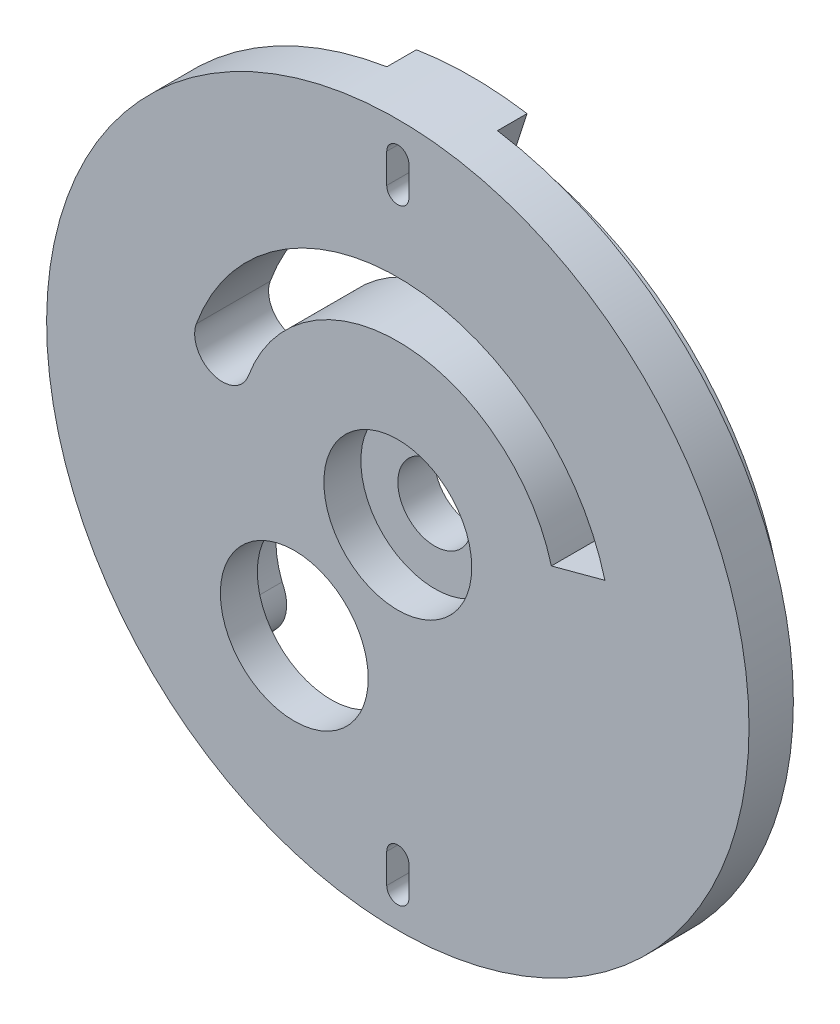
from build123d import *

# Parameters (mm, degrees)
ESQUISSE1_R             = 950
ESQUISSE1_R_2           = 100
ESQUISSE1_R_3           = 200
BOSS_EXTRU_2_DEPTH      = 200
ESQUISSE4_R             = 200
ENL_V_MAT_EXTRU_2_DEPTH = 100
ESQUISSE5_R             = 200
ENL_V_MAT_EXTRU_3_DEPTH = 100
ENL_V_MAT_EXTRU_4_DEPTH = 80


with BuildPart() as part:
    # Esquisse1 → Boss.-Extru.2 (new body)
    with BuildSketch(Plane.XY):
        Circle(ESQUISSE1_R)
        Circle(ESQUISSE1_R_2, mode=Mode.SUBTRACT)
        with Locations((-280, -400)):
            Circle(ESQUISSE1_R_3, mode=Mode.SUBTRACT)
        with BuildLine():
            Line((30, -780), (30, -860))
            ThreePointArc((30, -860), (0, -890), (-30, -860))
            Line((-30, -860), (-30, -780))
            ThreePointArc((-30, -780), (0, -750), (30, -780))
        make_face(mode=Mode.SUBTRACT)
        with BuildLine():
            Line((415.348105304, 111.292189394), (560.236979248, 150.115046159))
            ThreePointArc((560.236979248, 150.115046159), (25.299244672, 579.447968517), (-545.021720056, 198.371683129))
            ThreePointArc((-545.021720056, 198.371683129), (-500.196284246, 102.243225821), (-404.067826938, 147.06866163))
            ThreePointArc((-404.067826938, 147.06866163), (18.756336567, 429.59073528), (415.348105304, 111.292189394))
        make_face(mode=Mode.SUBTRACT)
        with BuildLine():
            Line((30, 780), (30, 860))
            ThreePointArc((30, 860), (0, 890), (-30, 860))
            Line((-30, 860), (-30, 780))
            ThreePointArc((-30, 780), (0, 750), (30, 780))
        make_face(mode=Mode.SUBTRACT)
    extrude(amount=BOSS_EXTRU_2_DEPTH)

    # Esquisse4 → Enlèv. mat.-Extru.2 (cut)
    with BuildSketch(Plane.XY.offset(200)):
        Circle(ESQUISSE4_R)
    extrude(amount=-ENL_V_MAT_EXTRU_2_DEPTH, mode=Mode.SUBTRACT)

    # Esquisse5 → Enlèv. mat.-Extru.3 (cut)
    with BuildSketch(Plane(origin=(0, 0, 0), x_dir=(-1, 0, 0), z_dir=(0, 0, -1))):
        with BuildLine():
            ThreePointArc((201.863253444, -825.682279638), (390.762908215, -754.853859739), (557.650174642, -641.503143189))
            Line((557.650174642, -641.503143189), (525.236890093, -604.21592467))
            ThreePointArc((525.236890093, -604.21592467), (501.276797335, -549.262070437), (513.052344937, -490.479856982))
            ThreePointArc((513.052344937, -490.479856982), (380.433331839, -171.060824987), (55.598868761, -289.799581223))
            ThreePointArc((55.598868761, -289.799581223), (12.641866668, -335.439232515), (-49.041983374, -346.547087517))
            ThreePointArc((-49.041983374, -346.547087517), (-213.58758579, -277.273048088), (-322.558312447, -135.853358705))
            ThreePointArc((-322.558312447, -135.853358705), (-366.878979382, -86.853774186), (-432.082648055, -76.187828748))
            Line((-432.082648055, -76.187828748), (-532.616227494, -93.91461127))
            ThreePointArc((-532.616227494, -93.91461127), (-602.060758652, -142.755312647), (-608.933484223, -227.376365948))
            ThreePointArc((-608.933484223, -227.376365948), (-372.346828507, -532.783107184), (-4.23006723, -649.986235648))
            ThreePointArc((-4.23006723, -649.986235648), (48.386746731, -665.352188625), (84.998557826, -706.147003376))
            Line((84.998557826, -706.147003376), (148.761821167, -836.881067155))
            ThreePointArc((148.761821167, -836.881067155), (175.401935414, -831.705573537), (201.863253444, -825.682279638))
        make_face()
        with Locations((280, -400)):
            Circle(ESQUISSE5_R, mode=Mode.SUBTRACT)
    extrude(amount=-ENL_V_MAT_EXTRU_3_DEPTH, mode=Mode.SUBTRACT)

    # Esquisse6 → Enlèv. mat.-Extru.4 (cut)
    with BuildSketch(Plane(origin=(0, 0, 0), x_dir=(-1, 0, 0), z_dir=(0, 0, -1))):
        with BuildLine():
            Line((-118.297135816, 841.72785843), (-149.624359786, 938.143139909))
            ThreePointArc((-149.624359786, 938.143139909), (-950, 0), (-149.624359786, -938.143139909))
            Line((-149.624359786, -938.143139909), (-118.297135816, -841.72785843))
            ThreePointArc((-118.297135816, -841.72785843), (-850, 0), (-118.297135816, 841.72785843))
        make_face()
        with BuildLine():
            Line((118.297135816, 841.72785843), (149.624359786, 938.143139909))
            ThreePointArc((149.624359786, 938.143139909), (950, 0), (149.624359786, -938.143139909))
            Line((149.624359786, -938.143139909), (118.297135816, -841.72785843))
            ThreePointArc((118.297135816, -841.72785843), (850, 0), (118.297135816, 841.72785843))
        make_face()
    extrude(amount=-ENL_V_MAT_EXTRU_4_DEPTH, mode=Mode.SUBTRACT)


solid = part.part
